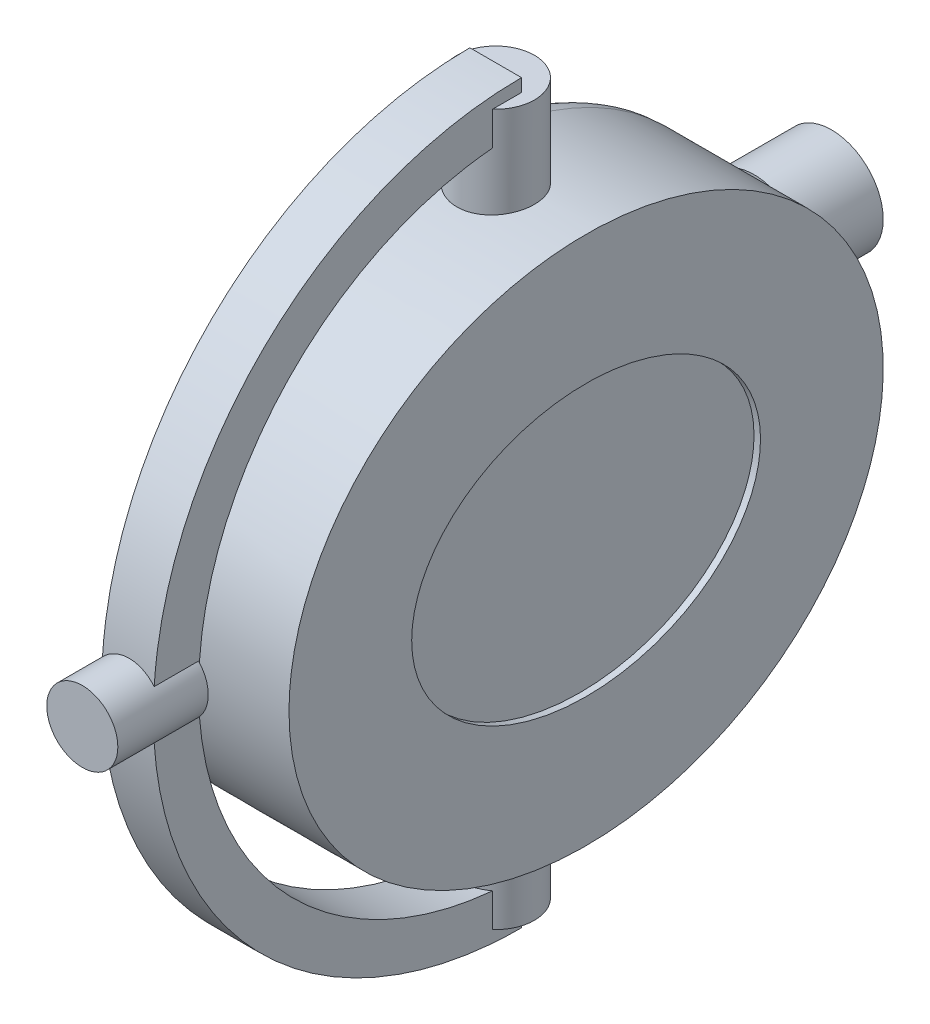
from build123d import *

# Parameters (mm, degrees)
SKETCH1_RX      = 46
SKETCH1_RY      = 41
HOUSING_DEPTH   = 14
HOUSINGFILLET_R = 6
YOKE_DEPTH      = 4
SKETCH3_R       = 6
HUBS_DEPTH      = 55
SKETCH4_R       = 5.5
STEM_DEPTH      = 7
SKETCH5_R       = 31
SKETCH5_R_2     = 27
CAPRING_DEPTH   = 0.6
SKETCH6_R       = 27
CAPDISC_DEPTH   = 0.3
SKETCH7_RX      = 27
SKETCH7_RY      = 21
GRILLE_DEPTH    = 1
SKETCH8_R       = 8
JACKBOSS_DEPTH  = 6
SKETCH9_R       = 3.4
JACKHOLE_DEPTH  = 18


with BuildPart() as part:
    # Sketch1 → Housing (new, symmetric)
    with BuildSketch(Plane.YZ):
        with Locations(Location((0, -56), (0, 0, -90))):
            Ellipse(SKETCH1_RX, SKETCH1_RY)
    extrude(amount=HOUSING_DEPTH, both=True)

    # HousingFillet
    housingfillet_edges = [part.edges().sort_by_distance(p)[0] for p in [
        (-14, -0.000843556, -10.00000001),
    ]]
    fillet(housingfillet_edges, radius=HOUSINGFILLET_R)



with BuildPart() as body_2:
    # Sketch2 → Yoke (new, symmetric)
    with BuildSketch(Plane.YZ):
        with BuildLine():
            Line((-57, -56), (-50, -56))
            add(Edge.make_bspline(
                [(-50, -56), (-50.000715835, -52.509268594), (-49.449257385, -47.273562429), (-47.639805857, -40.520886131), (-45.760836956, -35.62596381), (-43.380483611, -30.954265705), (-40.524849737, -26.556973368), (-37.225215755, -22.482265136), (-33.517734887, -18.774784182), (-29.443026604, -15.475150493), (-25.045734386, -12.619515533), (-20.374035854, -10.239166239), (-15.479115123, -8.360182216), (-10.414601967, -7.003150006), (-5.235984253, -6.182937538), (0, -5.908531231), (5.235984253, -6.182937538), (10.414601967, -7.003150006), (15.479115123, -8.360182216), (20.374035854, -10.239166239), (25.045734386, -12.619515533), (29.443026604, -15.475150493), (33.517734887, -18.774784182), (37.225215755, -22.482265136), (40.524849737, -26.556973368), (43.380483611, -30.954265705), (45.760836956, -35.62596381), (47.639805857, -40.520886131), (49.449257385, -47.273562429), (50.000715835, -52.509268594), (50, -56)],
                knots=[0, 0, 0, 0, 0.066666667, 0.1, 0.133333333, 0.166666667, 0.2, 0.233333333, 0.266666667, 0.3, 0.333333333, 0.366666667, 0.4, 0.433333333, 0.466666667, 0.5, 0.533333333, 0.566666667, 0.6, 0.633333333, 0.666666667, 0.7, 0.733333333, 0.766666667, 0.8, 0.833333333, 0.866666667, 0.9, 0.933333333, 1, 1, 1, 1], degree=3))
            Line((50, -56), (57, -56))
            add(Edge.make_bspline(
                [(57, -56), (57.000816052, -52.020566197), (56.372153418, -46.051861169), (54.309378677, -38.353810189), (52.16735413, -32.773598744), (49.453751316, -27.447862904), (46.1983287, -22.434949639), (42.43674596, -17.789782255), (38.210217772, -13.563253967), (33.565050328, -9.801671562), (28.5521372, -6.546247708), (23.226400873, -3.832649513), (17.64619124, -1.690607727), (11.872646243, -0.143591007), (5.969022049, 0.791451207), (0, 1.104274397), (-5.969022049, 0.791451207), (-11.872646243, -0.143591007), (-17.64619124, -1.690607727), (-23.226400873, -3.832649513), (-28.5521372, -6.546247708), (-33.565050328, -9.801671562), (-38.210217772, -13.563253967), (-42.43674596, -17.789782255), (-46.1983287, -22.434949639), (-49.453751316, -27.447862904), (-52.16735413, -32.773598744), (-54.309378677, -38.353810189), (-56.372153418, -46.051861169), (-57.000816052, -52.020566197), (-57, -56)],
                knots=[0, 0, 0, 0, 0.066666667, 0.1, 0.133333333, 0.166666667, 0.2, 0.233333333, 0.266666667, 0.3, 0.333333333, 0.366666667, 0.4, 0.433333333, 0.466666667, 0.5, 0.533333333, 0.566666667, 0.6, 0.633333333, 0.666666667, 0.7, 0.733333333, 0.766666667, 0.8, 0.833333333, 0.866666667, 0.9, 0.933333333, 1, 1, 1, 1], degree=3))
        make_face()
    extrude(amount=YOKE_DEPTH, both=True)


with BuildPart() as part_1:
    add(part.part)

    add(body_2.part)  # Hubs merges body 2
    # Sketch3 → Hubs (add, symmetric)
    with BuildSketch(Plane(origin=(0, 0, 0), x_dir=(-1, 0, 0), z_dir=(0, 1, 0))):
        with Locations(Location((0, -56, 0), (0, 0, 270))):
            Circle(SKETCH3_R)
    extrude(amount=HUBS_DEPTH, both=True)

    # Sketch4 → Stem (add, symmetric)
    with BuildSketch(Plane(origin=(0, 0, 1), x_dir=(0, 1, 0), z_dir=(0, 0, 1))):
        with Locations(Location((0, 0, 0), (0, 0, 46.658241773))):
            Circle(SKETCH4_R)
    extrude(amount=STEM_DEPTH, both=True)

    # Sketch5 → CapRing (add, symmetric)
    with BuildSketch(Plane.YZ.offset(-14.6)):
        with Locations(Location((0, -56, 0), (0, 0, 270))):
            Circle(SKETCH5_R)
        with Locations(Location((0, -56, 0), (0, 0, 270))):
            Circle(SKETCH5_R_2, mode=Mode.SUBTRACT)
    extrude(amount=CAPRING_DEPTH, both=True)

    # Sketch6 → CapDisc (add, symmetric)
    with BuildSketch(Plane.YZ.offset(-14.3)):
        with Locations(Location((0, -56, 0), (0, 0, 270))):
            Circle(SKETCH6_R)
    extrude(amount=CAPDISC_DEPTH, both=True)

    # Sketch7 → Grille (cut, symmetric)
    with BuildSketch(Plane.YZ.offset(14)):
        with Locations(Location((0, -56), (0, 0, -90))):
            Ellipse(SKETCH7_RX, SKETCH7_RY)
    extrude(amount=GRILLE_DEPTH, both=True, mode=Mode.SUBTRACT)

    # Sketch8 → JackBoss (add, symmetric)
    with BuildSketch(Plane(origin=(0, 0, -102), x_dir=(0, 1, 0), z_dir=(0, 0, 1))):
        with Locations(Location((14, 0, 0), (0, 0, 90))):
            Circle(SKETCH8_R)
    extrude(amount=JACKBOSS_DEPTH, both=True)

    # Sketch9 → JackHole (cut, symmetric)
    with BuildSketch(Plane(origin=(0, 0, -90), x_dir=(0, 1, 0), z_dir=(0, 0, 1))):
        with Locations(Location((14, 0, 0), (0, 0, 270))):
            Circle(SKETCH9_R)
    extrude(amount=JACKHOLE_DEPTH, both=True, mode=Mode.SUBTRACT)


solid = part_1.part
